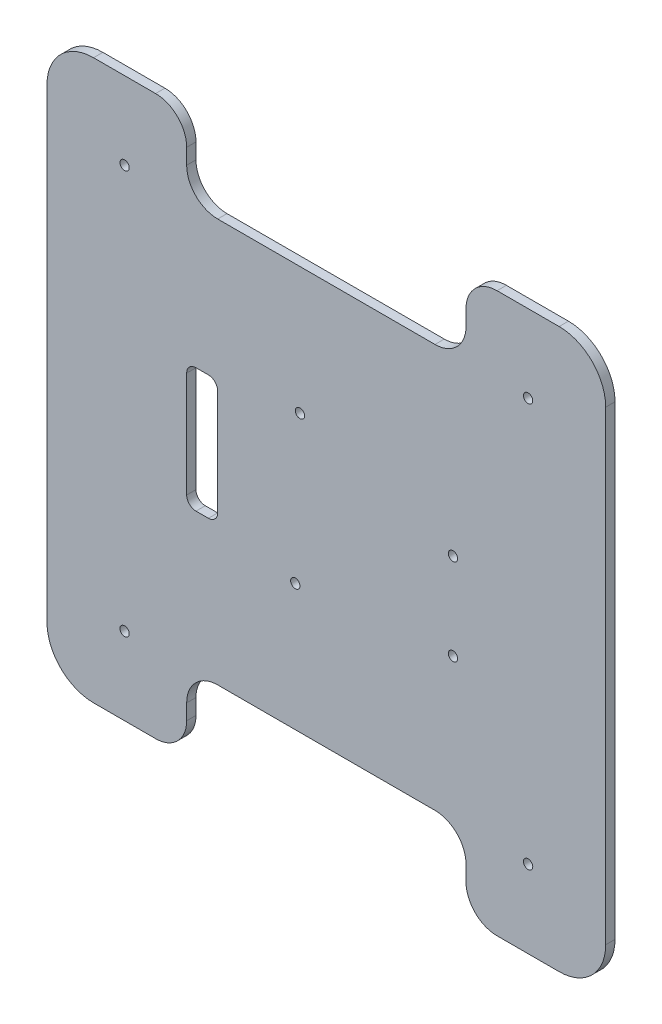
from build123d import *

# Parameters (mm, degrees)
EXTRUDE_1_DEPTH       = 3
HOLE_WIZARD_3_0_3_1_D = 3
SKETCH_7_W            = 90
SKETCH_7_H            = 25
CUT_EXTRUDE_1_DEPTH   = 128.314571044
FILLET_7_R            = 10
HOLE_WIZARD_3_0_3_2_D = 3
SKETCH1_W             = 10
SKETCH1_H             = 40
CUT_EXTRUDE1_DEPTH    = 128.314571044
FILLET1_R             = 3


with BuildPart() as part:
    # Эскиз1 → Бобышка-Вытянуть1 (new body)
    with BuildSketch(Plane.XY):
        with BuildLine():
            Line((75, -90), (-75, -90))
            ThreePointArc((-75, -90), (-85.606601718, -85.606601718), (-90, -75))
            Line((-90, -75), (-90, 75))
            ThreePointArc((-90, 75), (-85.606601718, 85.606601718), (-75, 90))
            Line((-75, 90), (75, 90))
            ThreePointArc((75, 90), (85.606601718, 85.606601718), (90, 75))
            Line((90, 75), (90, -75))
            ThreePointArc((90, -75), (85.606601718, -85.606601718), (75, -90))
        make_face()
    extrude(amount=EXTRUDE_1_DEPTH)

    # Диаметр отверстия Ø3.0 (3)1 (through all)
    with Locations(Plane.XY.offset(3)):
        with Locations((-10, -24.15), (40.8, 8.85), (40.8, -19.05), (-8.5, 24.05)):
            Hole(HOLE_WIZARD_3_0_3_1_D / 2)

    # Эскиз7 → Вырез-Вытянуть1 (cut, through all)
    with BuildSketch(Plane.XY.offset(3)):
        with Locations((0, 77.5)):
            Rectangle(SKETCH_7_W, SKETCH_7_H)
        with Locations((0, -77.5)):
            Rectangle(SKETCH_7_W, SKETCH_7_H)
    extrude(amount=-CUT_EXTRUDE_1_DEPTH, mode=Mode.SUBTRACT)

    # Скругление7
    fillet_7_edges = [part.edges().sort_by_distance(p)[0] for p in [
        (-45, 65, 1.5),
        (-45, 90, 1.5),
        (45, 90, 1.5),
        (45, 65, 1.5),
        (-45, -90, 1.5),
        (-45, -65, 1.5),
        (45, -65, 1.5),
        (45, -90, 1.5),
    ]]
    fillet(fillet_7_edges, radius=FILLET_7_R)

    # Диаметр отверстия Ø3.0 (3)2 (through all)
    with Locations(Plane.XY.offset(3)):
        with Locations((-65, -65), (65, -65), (65, 65), (-65, 65)):
            Hole(HOLE_WIZARD_3_0_3_2_D / 2)

    # Sketch1 → Cut-Extrude1 (cut, through all)
    with BuildSketch(Plane.XY.offset(3)):
        with Locations((-40, 0)):
            Rectangle(SKETCH1_W, SKETCH1_H)
    extrude(amount=-CUT_EXTRUDE1_DEPTH, mode=Mode.SUBTRACT)

    # Fillet1
    fillet1_edges = [part.edges().sort_by_distance(p)[0] for p in [
        (-35, 20, 1.5),
        (-35, -20, 1.5),
        (-45, -20, 1.5),
        (-45, 20, 1.5),
    ]]
    fillet(fillet1_edges, radius=FILLET1_R)


solid = part.part
